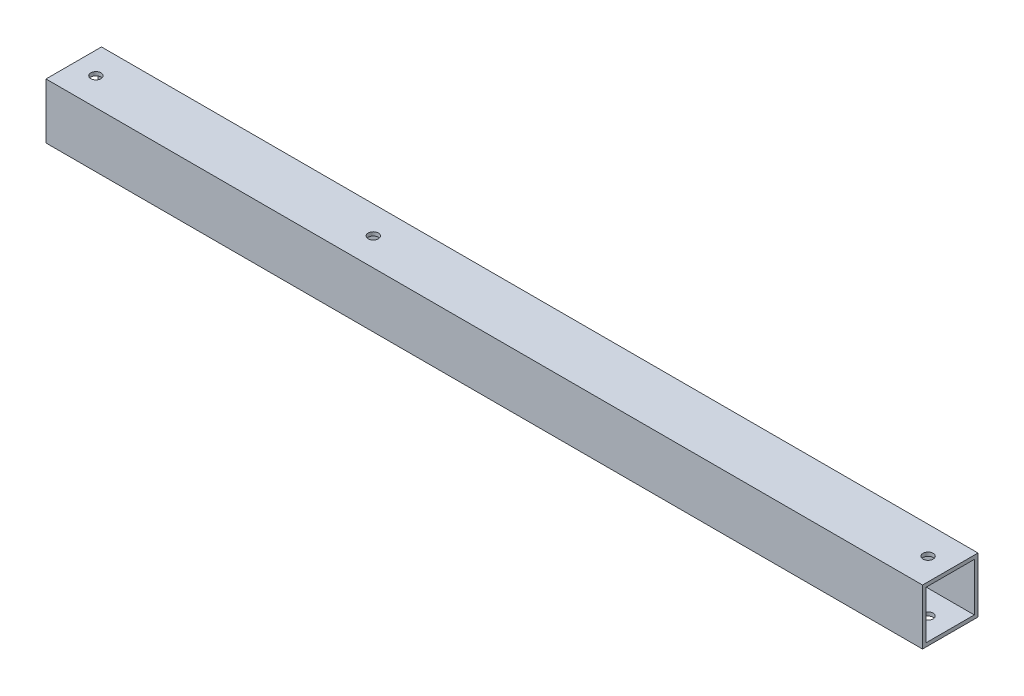
from build123d import *

# Parameters (mm, degrees)
SKETCH1_W               = 30
SKETCH1_H               = 30
SKETCH1_W_2             = 26
SKETCH1_H_2             = 26
BOSS_EXTRUDE1_DEPTH     = 237
SKETCH2_R               = 2.75
CUT_EXTRUDE1_DEPTH      = 238.947473195
CUT_EXTRUDE2_DEPTH      = 238.947473195
CUT_EXTRUDE2_DEPTH_BACK = 238.947473195
SKETCH3_R               = 2.75


with BuildPart() as part:
    # Sketch1 → Boss-Extrude1 (new, symmetric)
    with BuildSketch(Plane(origin=(0, 0, 0), x_dir=(0, 0, -1), z_dir=(1, 0, 0))):
        Rectangle(SKETCH1_W, SKETCH1_H)
        Rectangle(SKETCH1_W_2, SKETCH1_H_2, mode=Mode.SUBTRACT)
    extrude(amount=BOSS_EXTRUDE1_DEPTH, both=True)

    # Sketch2 → Cut-Extrude1 (cut, symmetric)
    with BuildSketch(Plane(origin=(0, 0, 0), x_dir=(1, 0, 0), z_dir=(0, 1, 0))):
        with Locations(Location((225, 0, 0), (0, 0, 270))):
            Circle(SKETCH2_R)
    cut_extrude1 = extrude(amount=CUT_EXTRUDE1_DEPTH, both=True, mode=Mode.SUBTRACT)

    # Mirror1: Cut-Extrude1 across plane
    add(cut_extrude1.mirror(Plane(origin=(0, 0, 0), x_dir=(0, 0, 1), z_dir=(1, 0, 0))), mode=Mode.SUBTRACT)

    # Sketch3 → Cut-Extrude2 (cut, two sides: drawn at the far end of the back side and taken through both)
    with BuildSketch(Plane(origin=(0, 0, 0), x_dir=(1, 0, 0), z_dir=(0, 1, 0)).offset(-CUT_EXTRUDE2_DEPTH_BACK)):
        with Locations(Location((-75, 0, 0), (0, 0, 270))):
            Circle(SKETCH3_R)
    extrude(amount=CUT_EXTRUDE2_DEPTH + CUT_EXTRUDE2_DEPTH_BACK, mode=Mode.SUBTRACT)


solid = part.part
